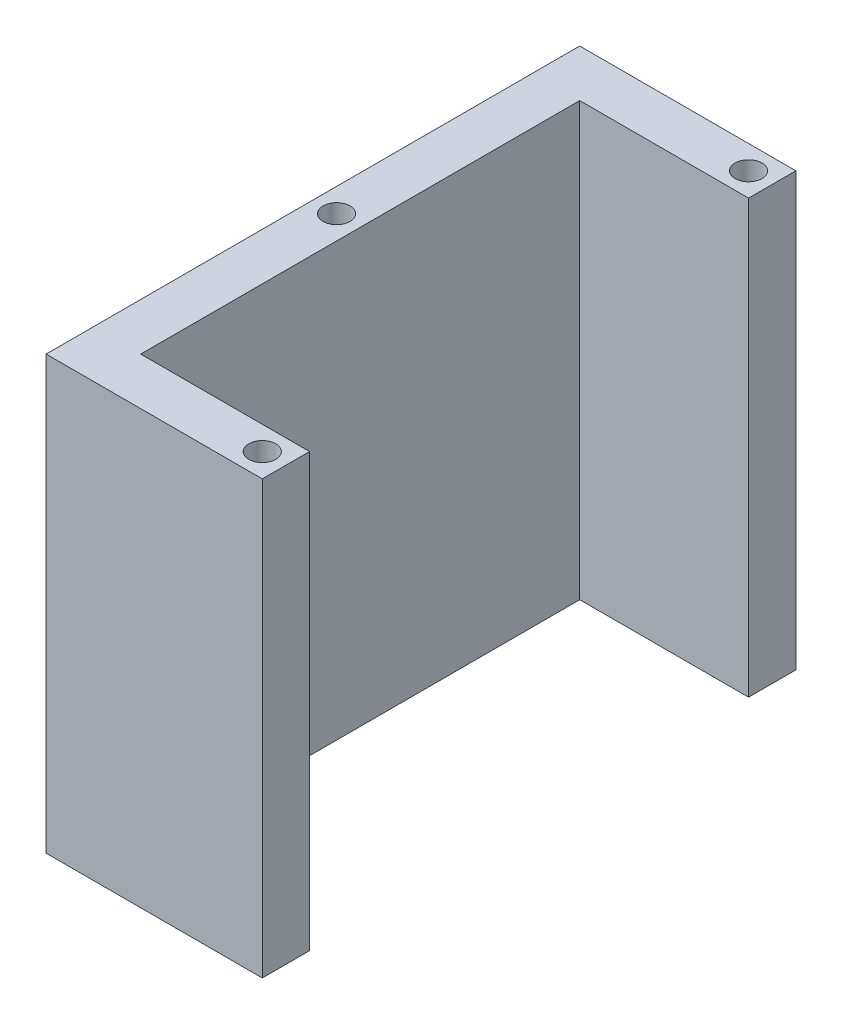
from build123d import *

# Parameters (mm, degrees)
BOSS_EXTRUDE1_DEPTH = 64
SKETCH2_R           = 2
CUT_EXTRUDE1_DEPTH  = 5.7
CUT_EXTRUDE2_START  = -5.7
SKETCH3_R           = 2
CUT_EXTRUDE2_DEPTH  = 5.7


with BuildPart() as part:
    # Sketch1 → Boss-Extrude1 (new body)
    with BuildSketch(Plane(origin=(0, 0, 0), x_dir=(1, 0, 0), z_dir=(0, 1, 0))):
        Polygon((-19.5, 39.5), (-19.5, -39.5), (12.5, -39.5), (12.5, -32.5), (-12.5, -32.5), (-12.5, 32.5), (12.5, 32.5), (12.5, 39.5), align=None)
    extrude(amount=BOSS_EXTRUDE1_DEPTH)

    # Sketch2 → Cut-Extrude1 (cut)
    with BuildSketch(Plane(origin=(0, 0, 0), x_dir=(1, 0, 0), z_dir=(0, 1, 0))):
        with Locations(Location((-16, 36, 0), (0, 0, 270))):
            Circle(SKETCH2_R)
        with Locations(Location((-16, -36, 0), (0, 0, 90))):
            Circle(SKETCH2_R)
        with Locations(Location((9, 36, 0), (0, 0, 270))):
            Circle(SKETCH2_R)
        with Locations(Location((9, -36, 0), (0, 0, 90))):
            Circle(SKETCH2_R)
    extrude(amount=CUT_EXTRUDE1_DEPTH, mode=Mode.SUBTRACT)

    # Sketch3 → Cut-Extrude2 (cut)
    with BuildSketch(Plane(origin=(0, 64, 0), x_dir=(1, 0, 0), z_dir=(0, 1, 0)).offset(CUT_EXTRUDE2_START)):
        with Locations(Location((-16, 0, 0), (0, 0, 270))):
            Circle(SKETCH3_R)
        with Locations(Location((9, -36, 0), (0, 0, 90))):
            Circle(SKETCH3_R)
        with Locations(Location((9, 36, 0), (0, 0, 270))):
            Circle(SKETCH3_R)
    extrude(amount=CUT_EXTRUDE2_DEPTH, mode=Mode.SUBTRACT)


solid = part.part
